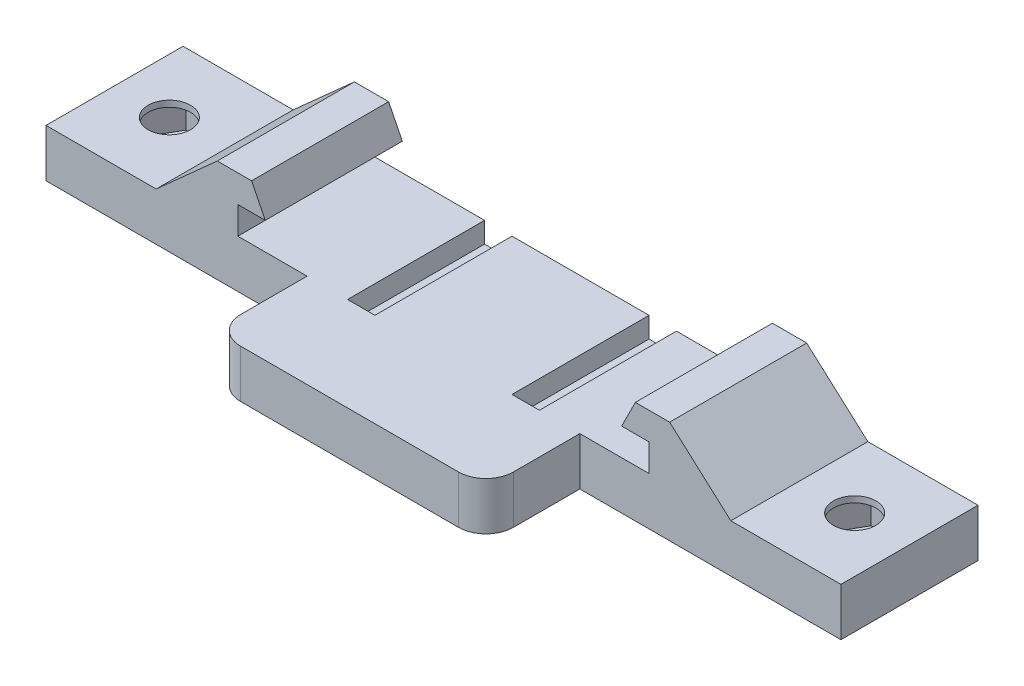
from build123d import *

# Parameters (mm, degrees)
SKETCH1_W           = 58
SKETCH1_H           = 10
BOSS_EXTRUDE1_DEPTH = 1.75
SKETCH2_R           = 1.55
CUT_EXTRUDE1_DEPTH  = 3.5
CUT_EXTRUDE2_DEPTH  = 1.3
SKETCH5_W           = 19.9
SKETCH5_H           = 23.7
BOSS_EXTRUDE2_DEPTH = 1.75
FILLET1_R           = 2
BOSS_EXTRUDE3_DEPTH = 5
SKETCH7_W           = 2
SKETCH7_H           = 10
CUT_EXTRUDE3_DEPTH  = 1.5
SKETCH8_W           = 23.808980199
SKETCH8_H           = 14.934673145
CUT_EXTRUDE4_DEPTH  = 5


with BuildPart() as part:
    # Sketch1 → Boss-Extrude1 (new, symmetric)
    with BuildSketch(Plane(origin=(0, 0, 0), x_dir=(1, 0, 0), z_dir=(0, 1, 0))):
        Rectangle(SKETCH1_W, SKETCH1_H)
    extrude(amount=BOSS_EXTRUDE1_DEPTH, both=True)

    # Sketch2 → Cut-Extrude1 (cut)
    with BuildSketch(Plane(origin=(0, 1.75, 0), x_dir=(1, 0, 0), z_dir=(0, 1, 0))):
        with Locations(Location((-25, 0, 0), (0, 0, 270))):
            Circle(SKETCH2_R)
        with Locations(Location((25, 0, 0), (0, 0, 270))):
            Circle(SKETCH2_R)
    extrude(amount=-CUT_EXTRUDE1_DEPTH, mode=Mode.SUBTRACT)

    # Sketch4 → Cut-Extrude2 (cut, symmetric)
    with BuildSketch(Plane(origin=(0, 0, 0), x_dir=(1, 0, 0), z_dir=(0, 1, 0))):
        Polygon((-28.290896534, 0), (-28.290896534, -2.85), (-26.645448267, -2.85), (-23.354551733, -2.85), (-21.709103466, -2.85), (-21.709103466, 0), (-23.354551733, 2.85), (-26.645448267, 2.85), align=None)
        Polygon((28.290896534, 0), (26.645448267, 2.85), (23.354551733, 2.85), (21.709103466, 0), (21.709103466, -2.85), (23.354551733, -2.85), (26.645448267, -2.85), (28.290896534, -2.85), align=None)
    extrude(amount=CUT_EXTRUDE2_DEPTH, both=True, mode=Mode.SUBTRACT)

    # Sketch5 → Boss-Extrude2 (add, symmetric)
    with BuildSketch(Plane(origin=(0, 0, 0), x_dir=(1, 0, 0), z_dir=(0, 1, 0))):
        Rectangle(SKETCH5_W, SKETCH5_H)
    extrude(amount=BOSS_EXTRUDE2_DEPTH, both=True)

    # Fillet1
    fillet1_edges = [part.edges().sort_by_distance(p)[0] for p in [
        (9.95, 0, 11.85),
        (-9.95, 0, 11.85),
    ]]
    fillet(fillet1_edges, radius=FILLET1_R)

    # Sketch6 → Boss-Extrude3 (add, symmetric)
    with BuildSketch(Plane.XY):
        Polygon((-20.964458506, 1.75), (-16.5, 5.75), (-14, 5.75), (-13, 3.75), (-15, 3.75), (-15, 1.75), align=None)
    boss_extrude3 = extrude(amount=BOSS_EXTRUDE3_DEPTH, both=True)

    # Mirror1: Boss-Extrude3 across plane
    add(boss_extrude3.mirror(Plane(origin=(0, 0, 0), x_dir=(0, 0, 1), z_dir=(1, 0, 0))))

    # Sketch7 → Cut-Extrude3 (cut)
    with BuildSketch(Plane(origin=(0, 1.75, 0), x_dir=(1, 0, 0), z_dir=(0, 1, 0))):
        with Locations((-6, 0)):
            Rectangle(SKETCH7_W, SKETCH7_H)
        with Locations((6, 0)):
            Rectangle(SKETCH7_W, SKETCH7_H)
    extrude(amount=-CUT_EXTRUDE3_DEPTH, mode=Mode.SUBTRACT)

    # Sketch8 → Cut-Extrude4 (cut, symmetric)
    with BuildSketch(Plane(origin=(0, 0, 0), x_dir=(1, 0, 0), z_dir=(0, 1, 0))):
        with Locations((0.433446228, 12.467336573)):
            Rectangle(SKETCH8_W, SKETCH8_H)
    extrude(amount=CUT_EXTRUDE4_DEPTH, both=True, mode=Mode.SUBTRACT)


solid = part.part
